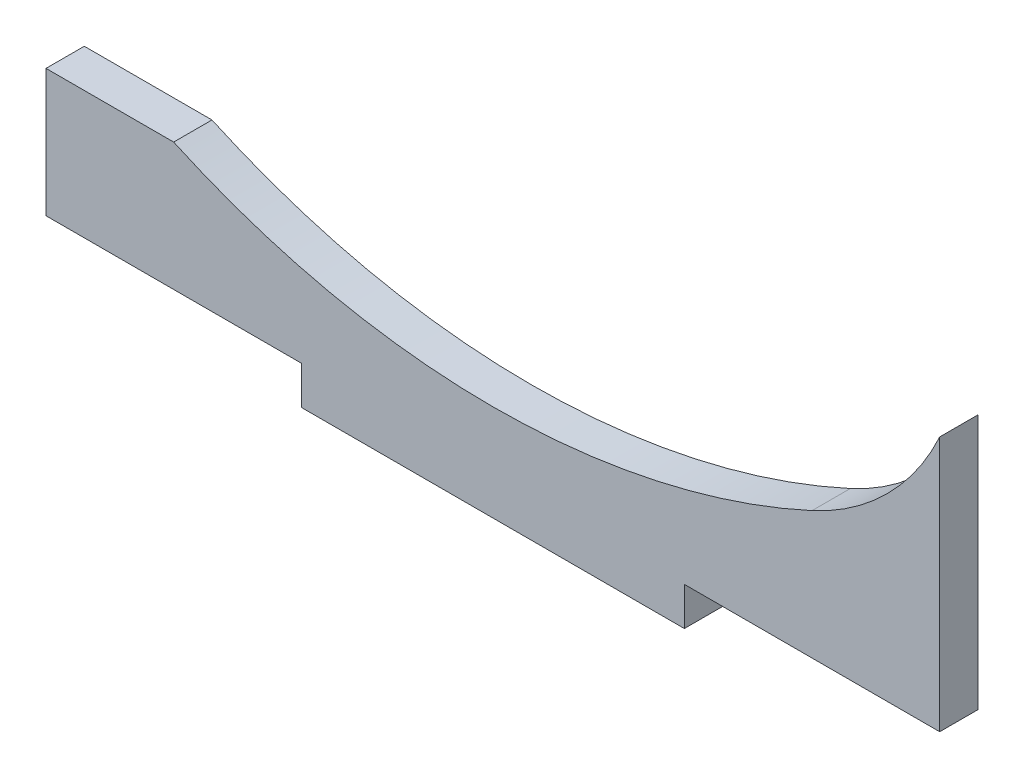
from build123d import *

# Parameters (mm, degrees)
BOSS_EXTRUDE1_DEPTH = 3


with BuildPart() as part:
    # Sketch1 → Boss-Extrude1 (new body)
    with BuildSketch(Plane.XY):
        with BuildLine():
            Line((0, 0), (-20, 0))
            Line((-20, 0), (-20, -3))
            Line((-20, -3), (-50, -3))
            Line((-50, -3), (-50, 0))
            Line((-50, 0), (-70, 0))
            Line((-70, 0), (-70, 10))
            Line((-70, 10), (-60, 10))
            ThreePointArc((-60, 10), (-35, 4.543560573), (-10, 10))
            ThreePointArc((-10, 10), (-4.101453402, 14.101453402), (0, 20))
            Line((0, 20), (0, 0))
        make_face()
    extrude(amount=BOSS_EXTRUDE1_DEPTH)


solid = part.part
